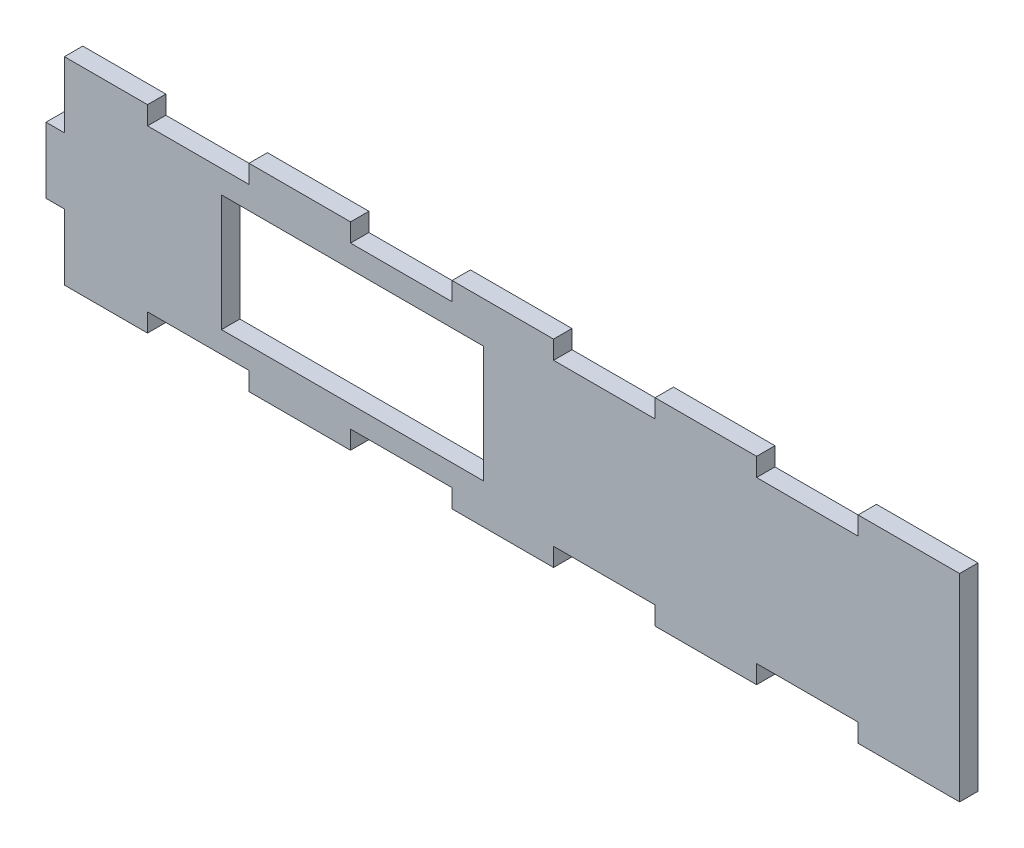
from build123d import *

# Parameters (mm, degrees)
SKETCH2_W           = 228.6
SKETCH2_H           = 49.499999806
BOSS_EXTRUDE1_DEPTH = 4.599999944
SKETCH4_W           = 25.4
SKETCH4_H           = 4.599999944
CUT_EXTRUDE1_DEPTH  = 234.943091328
SKETCH5_W           = 4.599999944
SKETCH5_H           = 16.499999935
CUT_EXTRUDE2_DEPTH  = 4.599999944
SKETCH6_W           = 65.500000064
SKETCH6_H           = 29.20000002
CUT_EXTRUDE3_DEPTH  = 270.181953409


with BuildPart() as part:
    # Sketch2 → Boss-Extrude1 (new body)
    with BuildSketch(Plane.XY):
        with Locations((114.3, 24.749999903)):
            Rectangle(SKETCH2_W, SKETCH2_H)
    extrude(amount=BOSS_EXTRUDE1_DEPTH)

    # Sketch4 → Cut-Extrude1 (cut, through all)
    with BuildSketch(Plane.XY.offset(4.599999944)):
        with Locations((38.1, 2.299999972)):
            Rectangle(SKETCH4_W, SKETCH4_H)
        with Locations((88.9, 2.299999972)):
            Rectangle(SKETCH4_W, SKETCH4_H)
        with Locations((139.7, 2.299999972)):
            Rectangle(SKETCH4_W, SKETCH4_H)
        with Locations((190.5, 2.299999972)):
            Rectangle(SKETCH4_W, SKETCH4_H)
    cut_extrude1 = extrude(amount=-CUT_EXTRUDE1_DEPTH, mode=Mode.SUBTRACT)

    # Mirror1: Cut-Extrude1 across plane
    add(cut_extrude1.mirror(Plane.ZX.offset(24.749999903)), mode=Mode.SUBTRACT)

    # Sketch5 → Cut-Extrude2 (cut)
    with BuildSketch(Plane.ZY):
        with Locations((2.299999972, 41.249999839)):
            Rectangle(SKETCH5_W, SKETCH5_H)
        with Locations((2.299999972, 8.249999968)):
            Rectangle(SKETCH5_W, SKETCH5_H)
    extrude(amount=-CUT_EXTRUDE2_DEPTH, mode=Mode.SUBTRACT)

    # Sketch6 → Cut-Extrude3 (cut, through all)
    with BuildSketch(Plane(origin=(29.45757895, -124.715298599, 49.499999806), x_dir=(1, 0, 0), z_dir=(0, 0, 1))):
        with Locations((47.200087569, 149.315298548)):
            Rectangle(SKETCH6_W, SKETCH6_H)
    extrude(amount=-CUT_EXTRUDE3_DEPTH, mode=Mode.SUBTRACT)


solid = part.part
